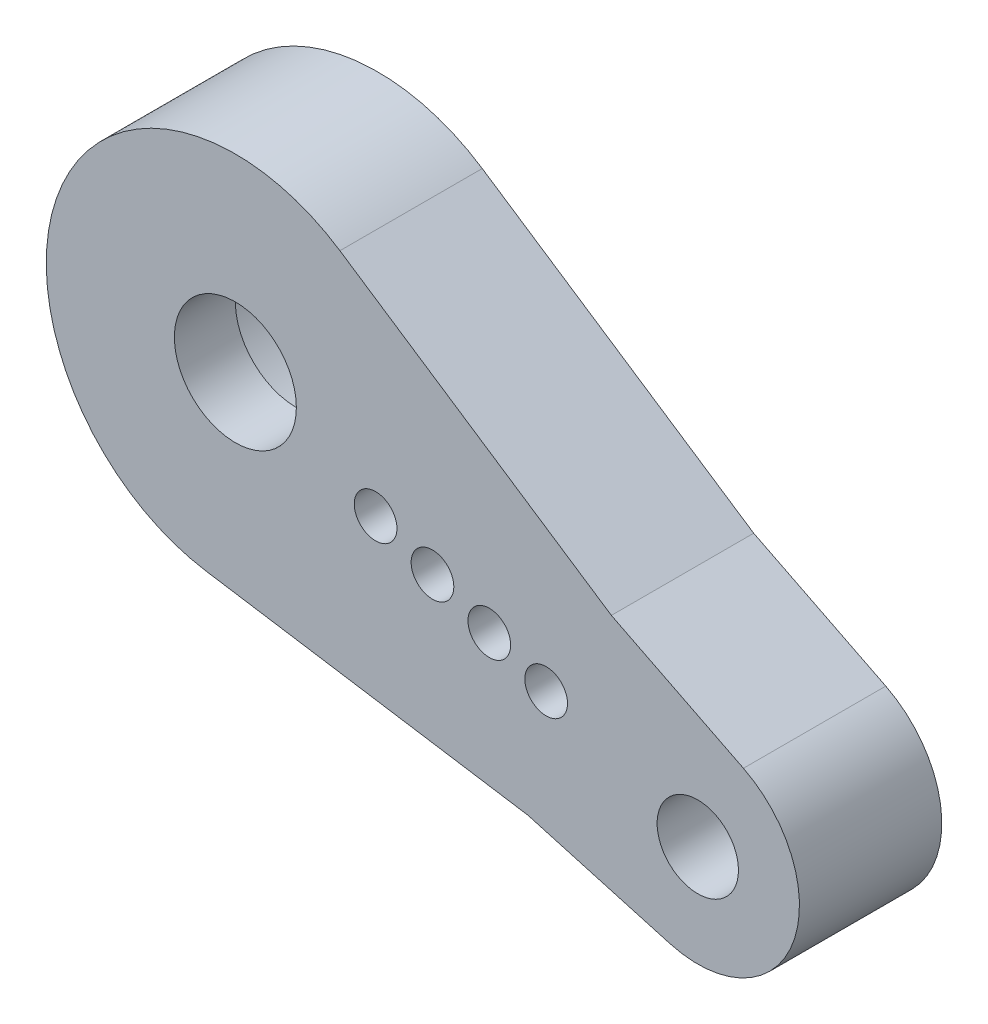
from build123d import *
from build123d.topology import SkipClean

# Parameters (mm, degrees)
EXTRUDE_1_DEPTH = 4
SKETCH_2_R      = 3
SKETCH_2_R_2    = 1.05
EXTRUDE_2_DEPTH = 3
EXTRUDE_START   = -7
SKETCH_3_R      = 2
EXTRUDE_3_DEPTH = 7


with BuildPart() as part:
    # Эскиз1 → Бобышка-Вытянуть1 (new body)
    with BuildSketch(Plane.XY):
        with BuildLine():
            Line((14.386891947, -11.67121845), (-1.44161316, -9.187586816))
            ThreePointArc((-1.44161316, -9.187586816), (-8.668259234, 3.369166345), (5.141479906, 7.74952801))
            Line((5.141479906, 7.74952801), (18.492476869, -1.108286623))
            ThreePointArc((18.492476869, -1.108286623), (20.691973654, -8.042526113), (14.386891947, -11.67121845))
        make_face()
        with BuildLine():
            Line((3.482938001, 5.249680265), (16.833934964, -3.608134368))
            ThreePointArc((16.833934964, -3.608134368), (17.895760998, -6.95569826), (14.85192845, -8.707480768))
            Line((14.85192845, -8.707480768), (-0.976576656, -6.223849133))
            ThreePointArc((-0.976576656, -6.223849133), (-5.872046578, 2.282338492), (3.482938001, 5.249680265))
        make_face(mode=Mode.SUBTRACT)
    extrude(amount=EXTRUDE_1_DEPTH)

    # Эскиз2 → Бобышка-Вытянуть2 (add)
    with SkipClean():  # the faces are left unmerged after this step: merging them gives an invalid solid
        with BuildSketch(Plane.XY.offset(4)):
            with BuildLine():
                Line((-1.44161316, -9.187586816), (14.386891947, -11.67121845))
                ThreePointArc((14.386891947, -11.67121845), (20.691973654, -8.042526113), (18.492476869, -1.108286623))
                Line((18.492476869, -1.108286623), (5.141479906, 7.74952801))
                ThreePointArc((5.141479906, 7.74952801), (-8.668259234, 3.369166345), (-1.44161316, -9.187586816))
            make_face()
            Circle(SKETCH_2_R, mode=Mode.SUBTRACT)
            with Locations((6.897324552, -2.680842038)):
                Circle(SKETCH_2_R_2, mode=Mode.SUBTRACT)
            with Locations((9.693537208, -3.767669891)):
                Circle(SKETCH_2_R_2, mode=Mode.SUBTRACT)
            with Locations((12.489749864, -4.854497744)):
                Circle(SKETCH_2_R_2, mode=Mode.SUBTRACT)
            with Locations((15.28596252, -5.941325597)):
                Circle(SKETCH_2_R_2, mode=Mode.SUBTRACT)
        extrude(amount=EXTRUDE_2_DEPTH)

    # Эскиз3 → Бобышка-Вытянуть3 (add)
    with SkipClean():  # the faces are left unmerged after this step: merging them gives an invalid solid
        with BuildSketch(Plane.XY.offset(7).offset(EXTRUDE_START)):
            with BuildLine():
                Line((18.492476869, -1.108286623), (24.987431668, -4.371825212))
                ThreePointArc((24.987431668, -4.371825212), (27.402884029, -10.650912961), (21.380978505, -13.650580764))
                Line((21.380978505, -13.650580764), (14.386891947, -11.67121845))
                ThreePointArc((14.386891947, -11.67121845), (20.691973654, -8.042526113), (18.492476869, -1.108286623))
            make_face()
            with Locations((22.742529602, -8.839533206)):
                Circle(SKETCH_3_R, mode=Mode.SUBTRACT)
        extrude(amount=EXTRUDE_3_DEPTH)


solid = part.part
